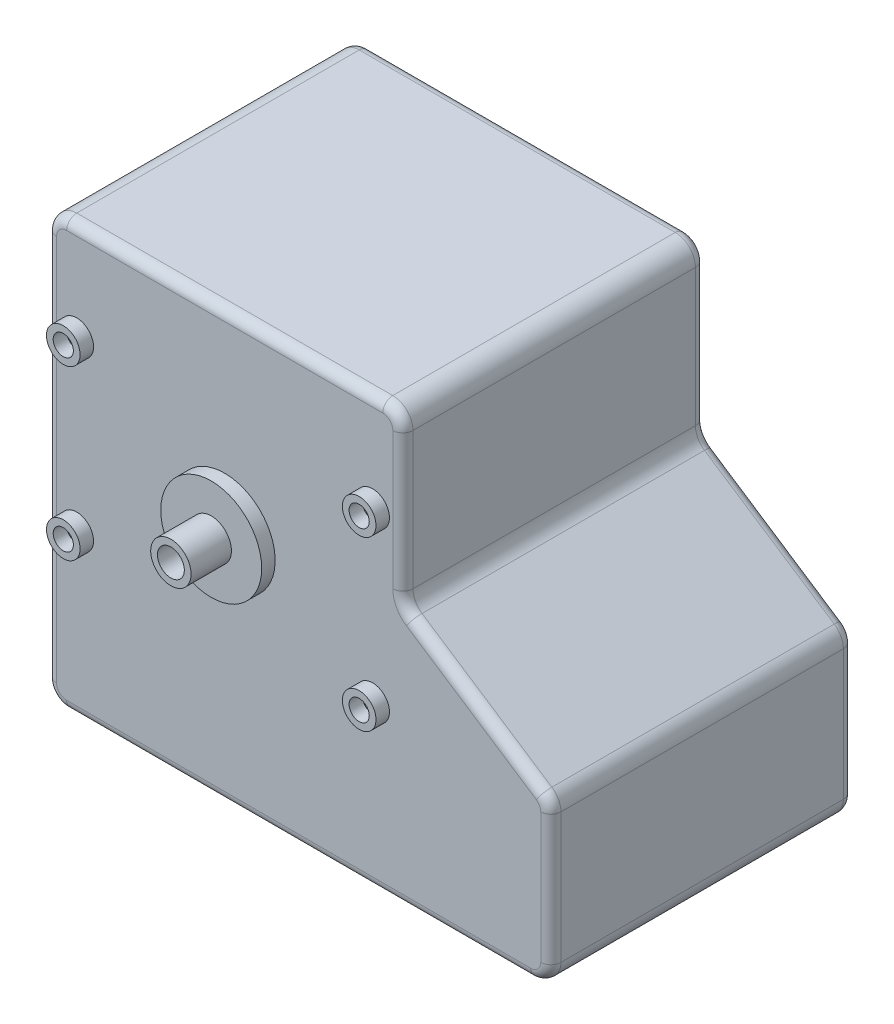
from build123d import *

# Parameters (mm, degrees)
BOSS_EXTRUDE1_DEPTH = 22.5
SKETCH3_R           = 2.5
SKETCH3_R_2         = 1.5
BOSS_EXTRUDE2_DEPTH = 2
SKETCH5_R           = 7.5
BOSS_EXTRUDE4_DEPTH = 2
FILLET1_R           = 3
FILLET2_R           = 1.5
SKETCH7_R           = 3
BOSS_EXTRUDE6_DEPTH = 6
SKETCH8_R           = 2
CUT_EXTRUDE2_DEPTH  = 79.544971195
BOSS_EXTRUDE7_DEPTH = 8


with BuildPart() as part:
    # Sketch2 → Boss-Extrude1 (new, symmetric)
    with BuildSketch(Plane.XY):
        Polygon((26.5, 6.75), (48.5, -7.75), (48.5, -31.75), (26.5, -31.75), (-26.5, -31.75), (-26.5, 31.75), (26.5, 31.75), align=None)
    extrude(amount=BOSS_EXTRUDE1_DEPTH, both=True)

    # Sketch3 → Boss-Extrude2 (add)
    # profile 1 of 4: a face of its own
    with BuildSketch(Plane.XY.offset(22.5)):
        with Locations(Location((-22, 17.25, 0), (0, 0, 180))):
            Circle(SKETCH3_R)
        with Locations((-22, 17.25)):
            Circle(SKETCH3_R_2, mode=Mode.SUBTRACT)
    # profile 2 of 4: a face of its own
    with BuildSketch(Plane.XY.offset(22.5)):
        with Locations(Location((22, 17.25, 0), (0, 0, 180))):
            Circle(SKETCH3_R)
        with Locations((22, 17.25)):
            Circle(SKETCH3_R_2, mode=Mode.SUBTRACT)
    # profile 3 of 4: a face of its own
    with BuildSketch(Plane.XY.offset(22.5)):
        with Locations(Location((-22, -7.75, 0), (0, 0, 180))):
            Circle(SKETCH3_R)
        with Locations((-22, -7.75)):
            Circle(SKETCH3_R_2, mode=Mode.SUBTRACT)
    # profile 4 of 4: a face of its own
    with BuildSketch(Plane.XY.offset(22.5)):
        with Locations(Location((22, -7.75, 0), (0, 0, 180))):
            Circle(SKETCH3_R)
        with Locations((22, -7.75)):
            Circle(SKETCH3_R_2, mode=Mode.SUBTRACT)
    extrude(amount=BOSS_EXTRUDE2_DEPTH)

    # Sketch5 → Boss-Extrude4 (add)
    with BuildSketch(Plane.XY.offset(22.5)):
        with Locations(Location((0, 3.25, 0), (0, 0, 180))):
            Circle(SKETCH5_R)
    extrude(amount=BOSS_EXTRUDE4_DEPTH)

    # Fillet1
    fillet1_edges = [part.edges().sort_by_distance(p)[0] for p in [
        (26.5, 6.75, 0),
        (48.5, -7.75, 0),
        (48.5, -31.75, 0),
        (-26.5, -31.75, 0),
        (-26.5, 31.75, 0),
        (26.5, 31.75, 0),
    ]]
    fillet(fillet1_edges, radius=FILLET1_R)

    # Fillet2
    fillet2_edges = [part.edges().sort_by_distance(p)[0] for p in [
        (11, -31.75, -22.5),
        (11, -31.75, 22.5),
        (26.5, 18.557860744, -22.5),
        (37.5, -0.5, -22.5),
        (48.5, -19.057860744, -22.5),
        (-26.5, 0, -22.5),
        (0, 31.75, -22.5),
        (25.621320344, 30.871320344, -22.5),
        (48.141289482, -7.943192097, -22.5),
        (47.621320344, -30.871320344, -22.5),
        (-25.621320344, 30.871320344, -22.5),
        (-25.621320344, -30.871320344, -22.5),
        (-26.5, 0, 22.5),
        (26.5, 18.557860744, 22.5),
        (0, 31.75, 22.5),
        (48.5, -19.057860744, 22.5),
        (37.5, -0.5, 22.5),
        (25.621320344, 30.871320344, 22.5),
        (48.141289482, -7.943192097, 22.5),
        (47.621320344, -30.871320344, 22.5),
        (-25.621320344, 30.871320344, 22.5),
        (-25.621320344, -30.871320344, 22.5),
        (26.858710518, 6.943192097, -22.5),
        (26.858710518, 6.943192097, 22.5),
    ]]
    fillet(fillet2_edges, radius=FILLET2_R)

    # Sketch7 → Boss-Extrude6 (add)
    with BuildSketch(Plane.XY.offset(24.5)):
        with Locations((0, 3.25)):
            Circle(SKETCH7_R)
    extrude(amount=BOSS_EXTRUDE6_DEPTH)

    # Sketch8 → Cut-Extrude2 (cut, through all)
    with BuildSketch(Plane.XY.offset(30.5)):
        with Locations((0, 3.25)):
            Circle(SKETCH8_R)
    extrude(amount=-CUT_EXTRUDE2_DEPTH, mode=Mode.SUBTRACT)

    # Sketch9 → Boss-Extrude7 (add)
    with BuildSketch(Plane(origin=(0, 0, -22.5), x_dir=(-1, 0, 0), z_dir=(0, 0, -1))):
        with BuildLine():
            Line((-7.5, -9.25), (7.5, -9.25))
            ThreePointArc((7.5, -9.25), (11.035533906, -7.785533906), (12.5, -4.25))
            Line((12.5, -4.25), (12.5, 10.75))
            ThreePointArc((12.5, 10.75), (11.035533906, 14.285533906), (7.5, 15.75))
            Line((7.5, 15.75), (-7.5, 15.75))
            ThreePointArc((-7.5, 15.75), (-11.035533906, 14.285533906), (-12.5, 10.75))
            Line((-12.5, 10.75), (-12.5, -4.25))
            ThreePointArc((-12.5, -4.25), (-11.035533906, -7.785533906), (-7.5, -9.25))
        make_face()
    extrude(amount=BOSS_EXTRUDE7_DEPTH)


solid = part.part
